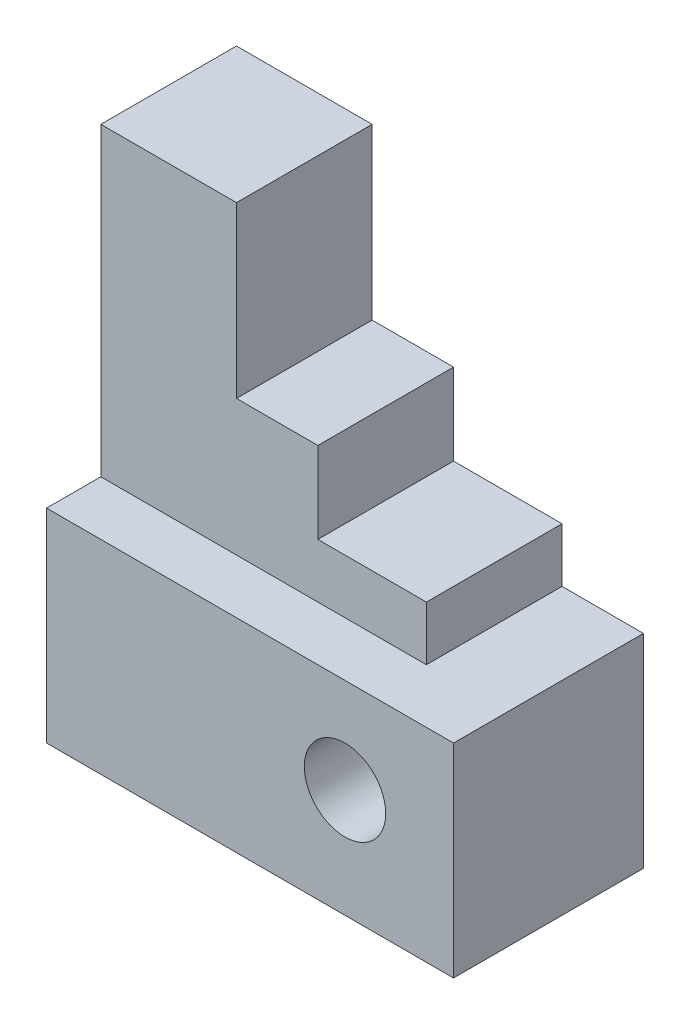
from build123d import *

# Parameters (mm, degrees)
CROQUIS1_R              = 6
SALIENTE_EXTRUIR2_DEPTH = 28
CROQUIS2_W              = 60
CROQUIS2_H              = 45
CORTAR_EXTRUIR2_DEPTH   = 8


with BuildPart() as part:
    # Croquis1 → Saliente-Extruir2 (new body)
    with BuildSketch(Plane.XY):
        Polygon((-33.447649851, 2.082931906), (26.552350149, 2.082931906), (26.552350149, 32.082931906), (14.552350149, 32.082931906), (14.552350149, 40.082931906), (-1.447649851, 40.082931906), (-1.447649851, 52.082931906), (-13.447649851, 52.082931906), (-13.447649851, 77.082931906), (-33.447649851, 77.082931906), align=None)
        with Locations((10.552350149, 18.082931906)):
            Circle(CROQUIS1_R, mode=Mode.SUBTRACT)
    extrude(amount=SALIENTE_EXTRUIR2_DEPTH)

    # Croquis2 → Cortar-Extruir2 (cut)
    with BuildSketch(Plane.XY.offset(28)):
        with Locations((-3.447649851, 54.582931906)):
            Rectangle(CROQUIS2_W, CROQUIS2_H)
    extrude(amount=-CORTAR_EXTRUIR2_DEPTH, mode=Mode.SUBTRACT)


solid = part.part
